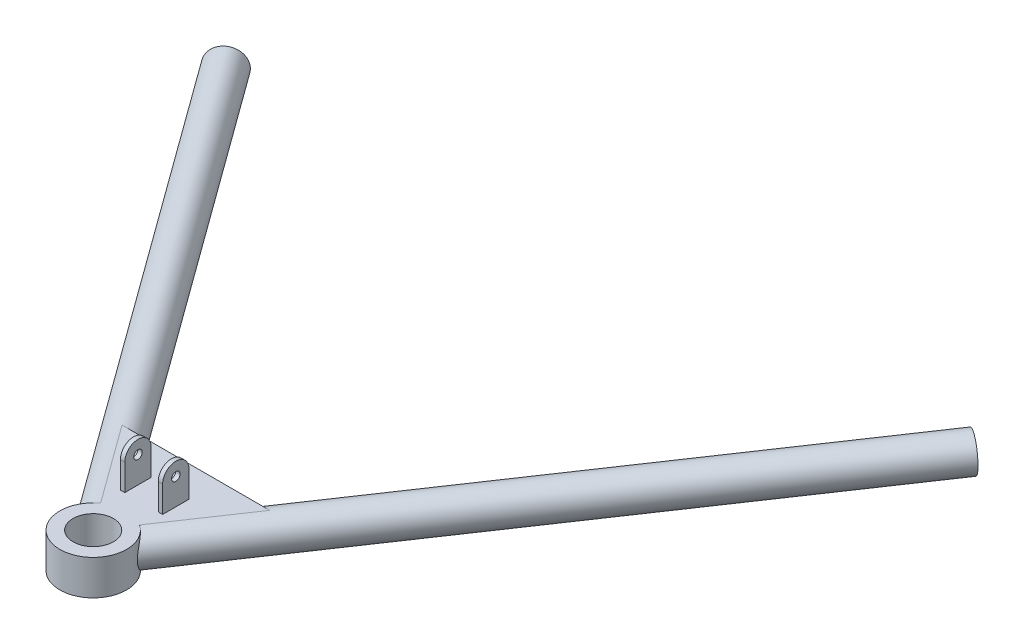
from build123d import *

# Parameters (mm, degrees)
SKETCH1_R                = 19.0062
SKETCH1_R_2              = 11.5062
BOSS_EXTRUDE1_DEPTH      = 10
BOSS_EXTRUDE2_REACH      = 389.442
SKETCH5_R                = 10
SKETCH5_R_2              = 7
BOSS_EXTRUDE3_REACH      = 508.152
BOSS_EXTRUDE3_END_RADIUS = 19.0062
SKETCH6_R                = 10
SKETCH6_R_2              = 7
BOSS_EXTRUDE7_DEPTH      = 7.5
SKETCH14_R               = 2.413
BOSS_EXTRUDE8_DEPTH      = 12.025
SKETCH14_2_R             = 2.413
CUT_EXTRUDE1_DEPTH       = 9.525


with BuildPart() as part:
    # Sketch1 → Boss-Extrude1 (new, symmetric)
    with BuildSketch(Plane(origin=(0, 0, 0), x_dir=(1, 0, 0), z_dir=(0, 1, 0))):
        Circle(SKETCH1_R)
        Circle(SKETCH1_R_2, mode=Mode.SUBTRACT)
    extrude(amount=BOSS_EXTRUDE1_DEPTH, both=True)

    # Sketch5 → Boss-Extrude2 (add, up to next)
    with BuildSketch(Plane(origin=(201.765365049, 0, -299.225174457), x_dir=(0.8291204994143476, 0, 0.5590699396774099), z_dir=(0.5590699396774099, 0, -0.8291204994143476)), mode=Mode.PRIVATE) as boss_extrude2_sk1:
        Circle(SKETCH5_R)
        Circle(SKETCH5_R_2, mode=Mode.SUBTRACT)
    boss_extrude2_tool1 = extrude(boss_extrude2_sk1.sketch, amount=-BOSS_EXTRUDE2_REACH, mode=Mode.PRIVATE) - part.part
    add(boss_extrude2_tool1.solids().sort_by_distance((193.708671, 0, -304.657745))[0])

    # Boss-Extrude3: up to this cylinder (the profile starts outside it)
    boss_extrude3_end = Plane(origin=(0, 0, 0), z_dir=(0, -1, 0)) * Cylinder(BOSS_EXTRUDE3_END_RADIUS, 1055.3164, mode=Mode.PRIVATE)
    # Sketch6 → Boss-Extrude3 (add, up to the surface)
    with BuildSketch(Plane(origin=(-200.850856434, 0, -276.365703762), x_dir=(-0.8089342810440551, 0, 0.5878990805841917), z_dir=(-0.5878990805841916, 0, -0.808934281044055)), mode=Mode.PRIVATE) as boss_extrude3_sk1:
        Circle(SKETCH6_R)
        Circle(SKETCH6_R_2, mode=Mode.SUBTRACT)
    boss_extrude3_tool1 = extrude(boss_extrude3_sk1.sketch, amount=-BOSS_EXTRUDE3_REACH, mode=Mode.PRIVATE) - boss_extrude3_end
    add(boss_extrude3_tool1.solids().sort_by_distance((-192.990315, 0, -282.078412))[0])

    # Sketch13 → Boss-Extrude7 (add)
    with BuildSketch(Plane(origin=(0, 10, 0), x_dir=(1, 0, 0), z_dir=(0, 1, 0))):
        with BuildLine():
            Line((10.625795087, 15.758430036), (40.457564859, 60))
            Line((40.457564859, 60), (-43.605451842, 60))
            Line((-43.605451842, 60), (-11.173727505, 15.374766732))
            ThreePointArc((-11.173727505, 15.374766732), (-0.334450095, 19.003257131), (10.625795087, 15.758430036))
        make_face()
    extrude(amount=-BOSS_EXTRUDE7_DEPTH)

    # Sketch14 → Boss-Extrude8 (add, symmetric)
    with BuildSketch(Plane.YZ):
        with BuildLine():
            Line((10, -27.5), (25, -27.5))
            ThreePointArc((25, -27.5), (32.5, -35), (25, -42.5))
            Line((25, -42.5), (10, -42.5))
            Line((10, -42.5), (10, -27.5))
        make_face()
        with Locations((25, -35)):
            Circle(SKETCH14_R, mode=Mode.SUBTRACT)
    extrude(amount=BOSS_EXTRUDE8_DEPTH, both=True)

    # Sketch14<2> → Cut-Extrude1 (cut, symmetric)
    with BuildSketch(Plane.YZ):
        with BuildLine():
            Line((10, -27.5), (25, -27.5))
            ThreePointArc((25, -27.5), (32.5, -35), (25, -42.5))
            Line((25, -42.5), (10, -42.5))
            Line((10, -42.5), (10, -27.5))
        make_face()
        with Locations((25, -35)):
            Circle(SKETCH14_2_R, mode=Mode.SUBTRACT)
    extrude(amount=CUT_EXTRUDE1_DEPTH, both=True, mode=Mode.SUBTRACT)


solid = part.part
